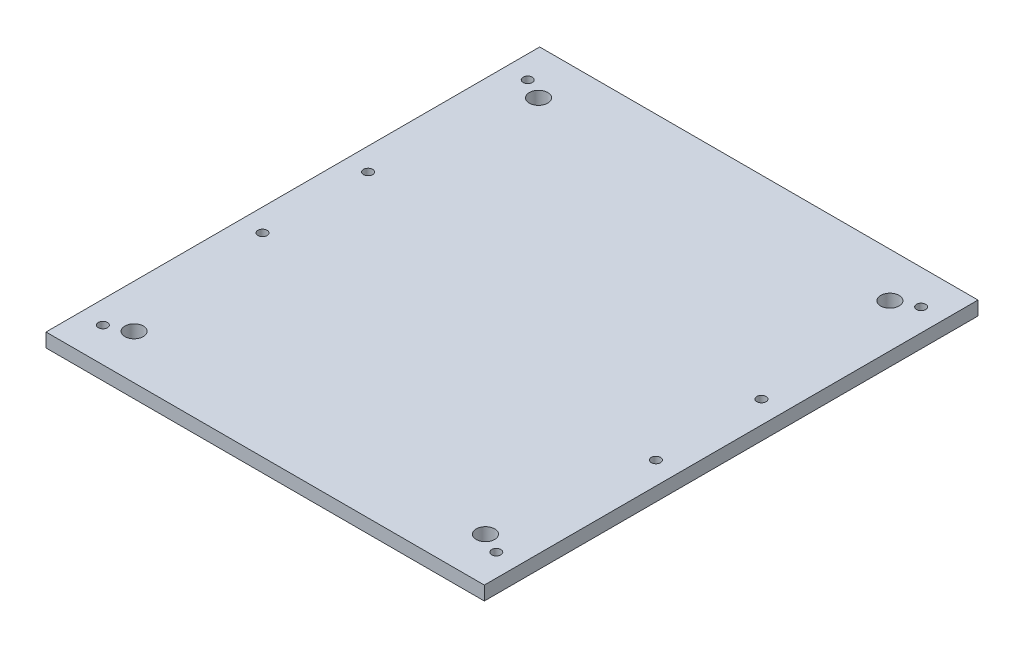
from build123d import *

# Parameters (mm, degrees)
SKETCH2_W                                  = 95
SKETCH2_H                                  = 107
SKETCH2_R                                  = 2
BOSS_EXTRUDE1_DEPTH                        = 3
SKETCH7_R                                  = 1
CUT_EXTRUDE2_DEPTH                         = 10
MIRROR3_COPY_1_SKETCH_R                    = 1
MIRROR3_COPY_1_DEPTH                       = 10
MIRROR3_AT_THE_SECOND_PLANE_COPY_1_SKETC_R = 1
MIRROR3_AT_THE_SECOND_PLANE_COPY_1_DEPTH   = 10
MIRROR3_AT_THE_SECOND_PLANE_COPY_2_SKETC_R = 1
MIRROR3_AT_THE_SECOND_PLANE_COPY_2_DEPTH   = 10
MIRROR3_AT_THE_SECOND_PLANE_COPY_3_SKETC_R = 1
MIRROR3_AT_THE_SECOND_PLANE_COPY_3_DEPTH   = 10


with BuildPart() as part:
    # Sketch2 → Boss-Extrude1 (new body)
    with BuildSketch(Plane(origin=(0, 0, 0), x_dir=(1, 0, 0), z_dir=(0, 1, 0))):
        Rectangle(SKETCH2_W, SKETCH2_H)
        with Locations(Location((38.075, -43.825, 0), (0, 0, 270))):
            Circle(SKETCH2_R, mode=Mode.SUBTRACT)
        with Locations(Location((38.075, 43.825, 0), (0, 0, 270))):
            Circle(SKETCH2_R, mode=Mode.SUBTRACT)
        with Locations(Location((-38.075, -43.825, 0), (0, 0, 270))):
            Circle(SKETCH2_R, mode=Mode.SUBTRACT)
        with Locations(Location((-38.075, 43.825, 0), (0, 0, 270))):
            Circle(SKETCH2_R, mode=Mode.SUBTRACT)
    extrude(amount=BOSS_EXTRUDE1_DEPTH)

    # Sketch7 → Cut-Extrude2 (cut)
    with BuildSketch(Plane(origin=(0, 3, 0), x_dir=(1, 0, 0), z_dir=(0, 1, 0))):
        with Locations(Location((42.63, 46.04, 0), (0, 0, 270))):
            Circle(SKETCH7_R)
    cut_extrude2 = extrude(amount=-CUT_EXTRUDE2_DEPTH, mode=Mode.SUBTRACT)

    # Mirror2: Cut-Extrude2 across plane
    add(cut_extrude2.mirror(Plane(origin=(0, 0, -28.738611276), x_dir=(1, 0, 0), z_dir=(0, 0, -1))), mode=Mode.SUBTRACT)

    # Mirror3: Cut-Extrude2 across plane
    add(cut_extrude2.mirror(Plane(origin=(0, 0, 0), x_dir=(0, 0, 1), z_dir=(1, 0, 0))), mode=Mode.SUBTRACT)

    # Mirror3 copy 1 sketch → Mirror3 copy 1 (cut)
    with BuildSketch(Plane(origin=(0, 3, -57.477222552), x_dir=(-1, 0, 0), z_dir=(0, 1, 0))):
        with Locations(Location((42.63, 46.04, 0), (0, 0, 270))):
            Circle(MIRROR3_COPY_1_SKETCH_R)
    extrude(amount=-MIRROR3_COPY_1_DEPTH, mode=Mode.SUBTRACT)

    # Mirror3 at the second plane: Cut-Extrude2 across plane
    add(cut_extrude2.mirror(Plane.XY), mode=Mode.SUBTRACT)

    # Mirror3 at the second plane copy 1 sketc → Mirror3 at the second plane copy 1 (cut)
    with BuildSketch(Plane(origin=(0, 3, 57.477222552), x_dir=(1, 0, 0), z_dir=(0, 1, 0))):
        with Locations(Location((42.63, 46.04, 0), (0, 0, 270))):
            Circle(MIRROR3_AT_THE_SECOND_PLANE_COPY_1_SKETC_R)
    extrude(amount=-MIRROR3_AT_THE_SECOND_PLANE_COPY_1_DEPTH, mode=Mode.SUBTRACT)

    # Mirror3 at the second plane copy 2 sketc → Mirror3 at the second plane copy 2 (cut)
    with BuildSketch(Plane(origin=(0, 3, 0), x_dir=(-1, 0, 0), z_dir=(0, 1, 0))):
        with Locations(Location((42.63, 46.04, 0), (0, 0, 270))):
            Circle(MIRROR3_AT_THE_SECOND_PLANE_COPY_2_SKETC_R)
    extrude(amount=-MIRROR3_AT_THE_SECOND_PLANE_COPY_2_DEPTH, mode=Mode.SUBTRACT)

    # Mirror3 at the second plane copy 3 sketc → Mirror3 at the second plane copy 3 (cut)
    with BuildSketch(Plane(origin=(0, 3, 57.477222552), x_dir=(-1, 0, 0), z_dir=(0, 1, 0))):
        with Locations((42.63, -46.04)):
            Circle(MIRROR3_AT_THE_SECOND_PLANE_COPY_3_SKETC_R)
    extrude(amount=-MIRROR3_AT_THE_SECOND_PLANE_COPY_3_DEPTH, mode=Mode.SUBTRACT)


solid = part.part
